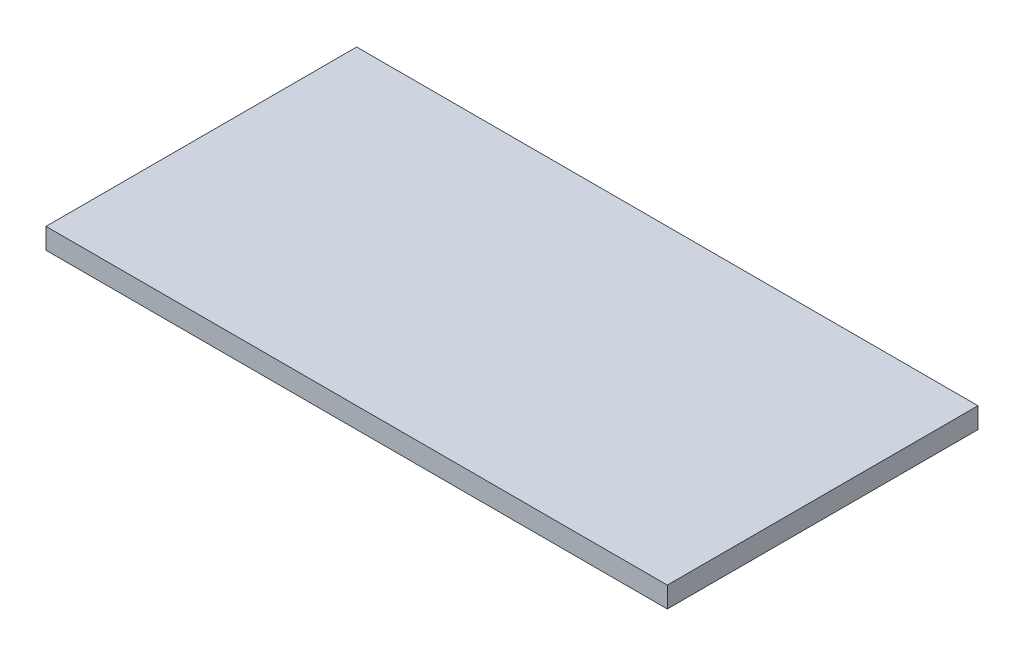
from build123d import *

# Parameters (mm, degrees)
SKETCH1_W           = 30
SKETCH1_H           = 15
BOSS_EXTRUDE1_DEPTH = 1


with BuildPart() as part:
    # Sketch1 → Boss-Extrude1 (new body)
    with BuildSketch(Plane(origin=(0, 0, 0), x_dir=(1, 0, 0), z_dir=(0, 1, 0))):
        with Locations((6.712158809, -3.61662531)):
            Rectangle(SKETCH1_W, SKETCH1_H)
    extrude(amount=BOSS_EXTRUDE1_DEPTH)


solid = part.part
